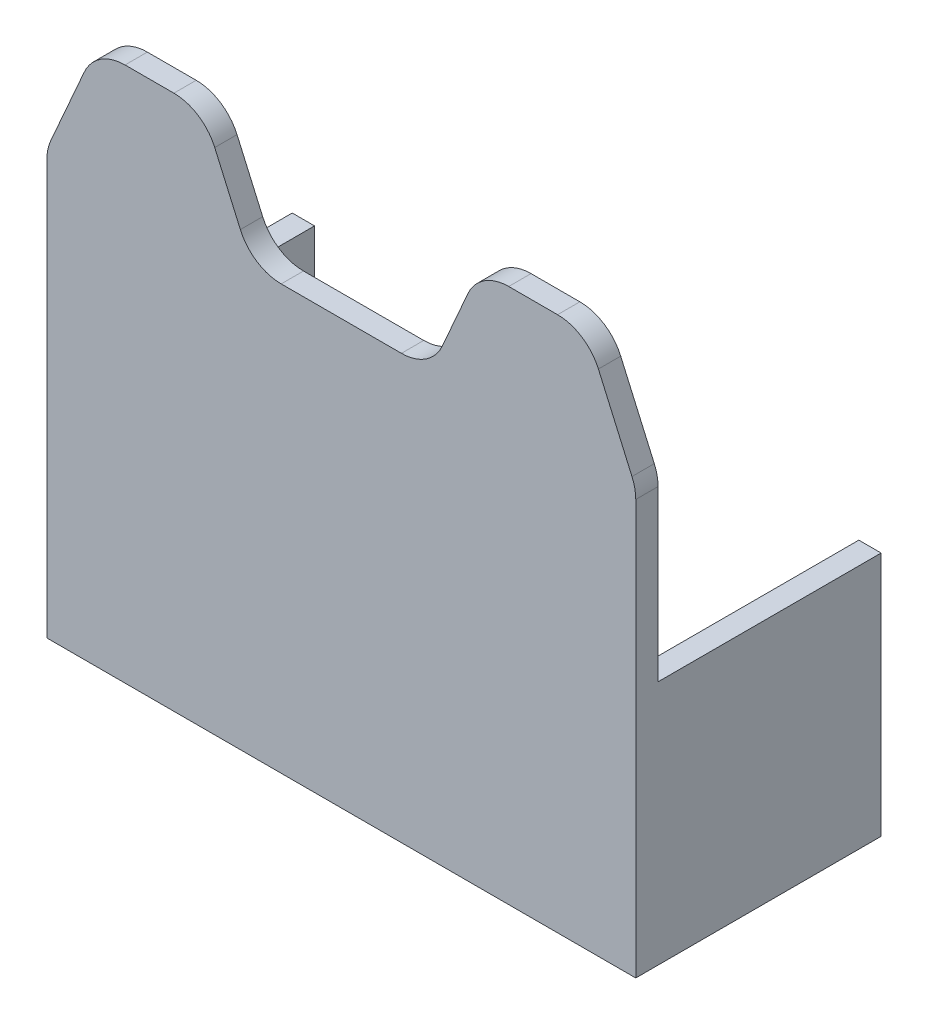
from build123d import *

# Parameters (mm, degrees)
EXTRUDE_1_DEPTH     = 50
SKETCH_2_R          = 2.5
EXTRUDE_2_DEPTH     = 5
CUT_EXTRUDE_2_DEPTH = 2
SKETCH_7_W          = 132
SKETCH_7_H          = 55
EXTRUDE_3_DEPTH     = 5
SKETCH_8_W          = 122
SKETCH_8_H          = 5
CUT_EXTRUDE_3_DEPTH = 50
EXTRUDE_4_DEPTH     = 5
FILLET_1_R          = 10
FILLET_2_R          = 10
FILLET_3_R          = 10
FILLET_4_R          = 10
FILLET_5_R          = 10
FILLET_6_R          = 10
FILLET_7_R          = 10
FILLET_8_R          = 10


with BuildPart() as part:
    # 草图1 → 凸台-拉伸1 (new body)
    with BuildSketch(Plane.XY):
        Polygon((-66, 30), (66, 30), (66, -25), (61, -25), (61, 25), (-61, 25), (-61, -25), (-66, -25), align=None)
    extrude(amount=EXTRUDE_1_DEPTH)

    # 草图2 → 凸台-拉伸2 (add)
    # profile 1 of 2: a face of its own
    with BuildSketch(Plane.XY):
        with BuildLine():
            Line((-61, -13), (-53.5, -13))
            ThreePointArc((-53.5, -13), (-47.5, -19), (-53.5, -25))
            Line((-53.5, -25), (-61, -25))
            Line((-61, -25), (-61, -13))
        make_face()
        with Locations((-53.5, -19)):
            Circle(SKETCH_2_R, mode=Mode.SUBTRACT)
    # profile 2 of 2: a face of its own
    with BuildSketch(Plane.XY):
        with BuildLine():
            Line((61, -25), (53.5, -25))
            ThreePointArc((53.5, -25), (47.5, -19), (53.5, -13))
            Line((53.5, -13), (61, -13))
            Line((61, -13), (61, -25))
        make_face()
        with Locations((53.5, -19)):
            Circle(SKETCH_2_R, mode=Mode.SUBTRACT)
    extrude(amount=EXTRUDE_2_DEPTH)

    # 草图6 → 切除-拉伸2 (cut)
    with BuildSketch(Plane.XY.offset(5)):
        Polygon((-49.74722325, -19), (-51.623611625, -15.75), (-55.376388375, -15.75), (-57.25277675, -19), (-55.376388375, -22.25), (-51.623611625, -22.25), align=None)
        Polygon((57.25277675, -19), (55.376388375, -15.75), (51.623611625, -15.75), (49.74722325, -19), (51.623611625, -22.25), (55.376388375, -22.25), align=None)
    extrude(amount=-CUT_EXTRUDE_2_DEPTH, mode=Mode.SUBTRACT)

    # 草图7 → 凸台-拉伸3 (add)
    with BuildSketch(Plane.XY.offset(50)):
        with Locations((0, 2.5)):
            Rectangle(SKETCH_7_W, SKETCH_7_H)
    extrude(amount=EXTRUDE_3_DEPTH)

    # 草图8 → 切除-拉伸3 (cut)
    with BuildSketch(Plane(origin=(0, 0, 0), x_dir=(-1, 0, 0), z_dir=(0, 0, -1))):
        with Locations((0, 27.5)):
            Rectangle(SKETCH_8_W, SKETCH_8_H)
    extrude(amount=-CUT_EXTRUDE_3_DEPTH, mode=Mode.SUBTRACT)

    # 草图9 → 凸台-拉伸4 (add)
    with BuildSketch(Plane.XY.offset(55)):
        Polygon((-66, 30), (66, 30), (66, 70), (55, 95), (31, 95), (20, 70), (-20, 70), (-31, 95), (-55, 95), (-66, 70), align=None)
    extrude(amount=-EXTRUDE_4_DEPTH)

    # 圆角1
    fillet_1_edges = [part.edges().sort_by_distance(p)[0] for p in [
        (-66, 70, 52.5),
    ]]
    fillet(fillet_1_edges, radius=FILLET_1_R)

    # 圆角2
    fillet_2_edges = [part.edges().sort_by_distance(p)[0] for p in [
        (-55, 95, 52.5),
    ]]
    fillet(fillet_2_edges, radius=FILLET_2_R)

    # 圆角3
    fillet_3_edges = [part.edges().sort_by_distance(p)[0] for p in [
        (66, 70, 52.5),
    ]]
    fillet(fillet_3_edges, radius=FILLET_3_R)

    # 圆角4
    fillet_4_edges = [part.edges().sort_by_distance(p)[0] for p in [
        (-31, 95, 52.5),
    ]]
    fillet(fillet_4_edges, radius=FILLET_4_R)

    # 圆角5
    fillet_5_edges = [part.edges().sort_by_distance(p)[0] for p in [
        (-20, 70, 52.5),
    ]]
    fillet(fillet_5_edges, radius=FILLET_5_R)

    # 圆角6
    fillet_6_edges = [part.edges().sort_by_distance(p)[0] for p in [
        (20, 70, 52.5),
    ]]
    fillet(fillet_6_edges, radius=FILLET_6_R)

    # 圆角7
    fillet_7_edges = [part.edges().sort_by_distance(p)[0] for p in [
        (31, 95, 52.5),
    ]]
    fillet(fillet_7_edges, radius=FILLET_7_R)

    # 圆角8
    fillet_8_edges = [part.edges().sort_by_distance(p)[0] for p in [
        (55, 95, 52.5),
    ]]
    fillet(fillet_8_edges, radius=FILLET_8_R)


solid = part.part
